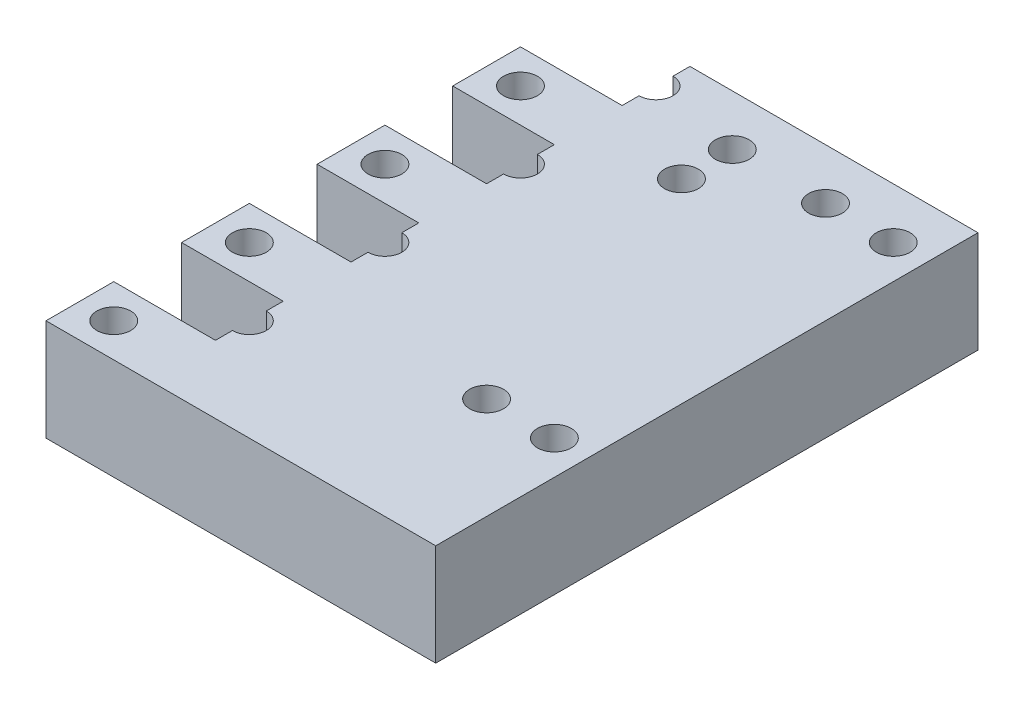
from build123d import *

# Parameters (mm, degrees)
BOSS_EXTRUDE1_DEPTH = 6
SKETCH2_R           = 1
CUT_EXTRUDE1_DEPTH  = 40.862262856
SKETCH3_R           = 1
CUT_EXTRUDE2_DEPTH  = 40.862262856


with BuildPart() as part:
    # Sketch1 → Boss-Extrude1 (new body)
    with BuildSketch(Plane(origin=(0, 0, 0), x_dir=(1, 0, 0), z_dir=(0, 1, 0))):
        Polygon((0, 0), (0, 4), (6, 4), (6, 8), (0, 8), (0, 12), (6, 12), (6, 16), (0, 16), (0, 20), (6, 20), (6, 24), (0, 24), (0, 28), (6, 28), (6, 32), (23, 32), (23, 0), align=None)
    extrude(amount=BOSS_EXTRUDE1_DEPTH)

    # Sketch2 → Cut-Extrude1 (cut, through all)
    with BuildSketch(Plane(origin=(0, 6, 0), x_dir=(1, 0, 0), z_dir=(0, 1, 0))):
        with Locations(Location((2, 26, 0), (0, 0, 270))):
            Circle(SKETCH2_R)
        with Locations(Location((2, 18, 0), (0, 0, 270))):
            Circle(SKETCH2_R)
        with Locations(Location((2, 10, 0), (0, 0, 270))):
            Circle(SKETCH2_R)
        with Locations(Location((2, 2, 0), (0, 0, 270))):
            Circle(SKETCH2_R)
        with Locations((6, 22)):
            Circle(SKETCH2_R)
        with Locations((6, 30)):
            Circle(SKETCH2_R)
        with Locations((6, 14)):
            Circle(SKETCH2_R)
        with Locations((6, 6)):
            Circle(SKETCH2_R)
        with Locations(Location((21, 29, 0), (0, 0, 270))):
            Circle(SKETCH2_R)
        with Locations(Location((21, 9, 0), (0, 0, 270))):
            Circle(SKETCH2_R)
        with Locations(Location((17, 29, 0), (0, 0, 270))):
            Circle(SKETCH2_R)
        with Locations(Location((17, 9, 0), (0, 0, 270))):
            Circle(SKETCH2_R)
    extrude(amount=-CUT_EXTRUDE1_DEPTH, mode=Mode.SUBTRACT)

    # Sketch3 → Cut-Extrude2 (cut, through all)
    with BuildSketch(Plane(origin=(0, 6, 0), x_dir=(1, 0, 0), z_dir=(0, 1, 0))):
        with Locations(Location((11.5, 29, 0), (0, 0, 270))):
            Circle(SKETCH3_R)
        with Locations(Location((11.5, 26, 0), (0, 0, 270))):
            Circle(SKETCH3_R)
    extrude(amount=-CUT_EXTRUDE2_DEPTH, mode=Mode.SUBTRACT)


solid = part.part
